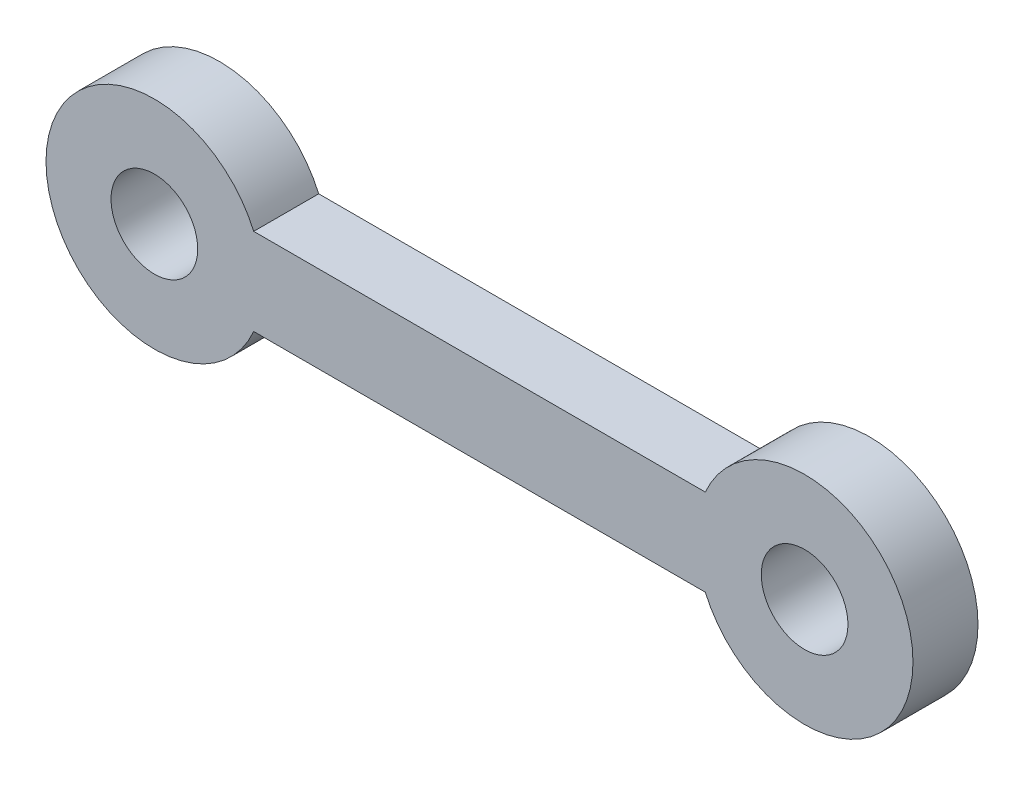
from build123d import *

# Parameters (mm, degrees)
SKETCH_2_R      = 2
EXTRUDE_1_DEPTH = 1.5


with BuildPart() as part:
    # 草图2 → 凸台-拉伸1 (new, symmetric)
    with BuildSketch(Plane.XY):
        with BuildLine():
            Line((4.582575695, 2), (25.417424305, 2))
            ThreePointArc((25.417424305, 2), (35, 0), (25.417424305, -2))
            Line((25.417424305, -2), (4.582575695, -2))
            ThreePointArc((4.582575695, -2), (-5, 0), (4.582575695, 2))
        make_face()
        Circle(SKETCH_2_R, mode=Mode.SUBTRACT)
        with Locations((30, 0)):
            Circle(SKETCH_2_R, mode=Mode.SUBTRACT)
    extrude(amount=EXTRUDE_1_DEPTH, both=True)


solid = part.part
